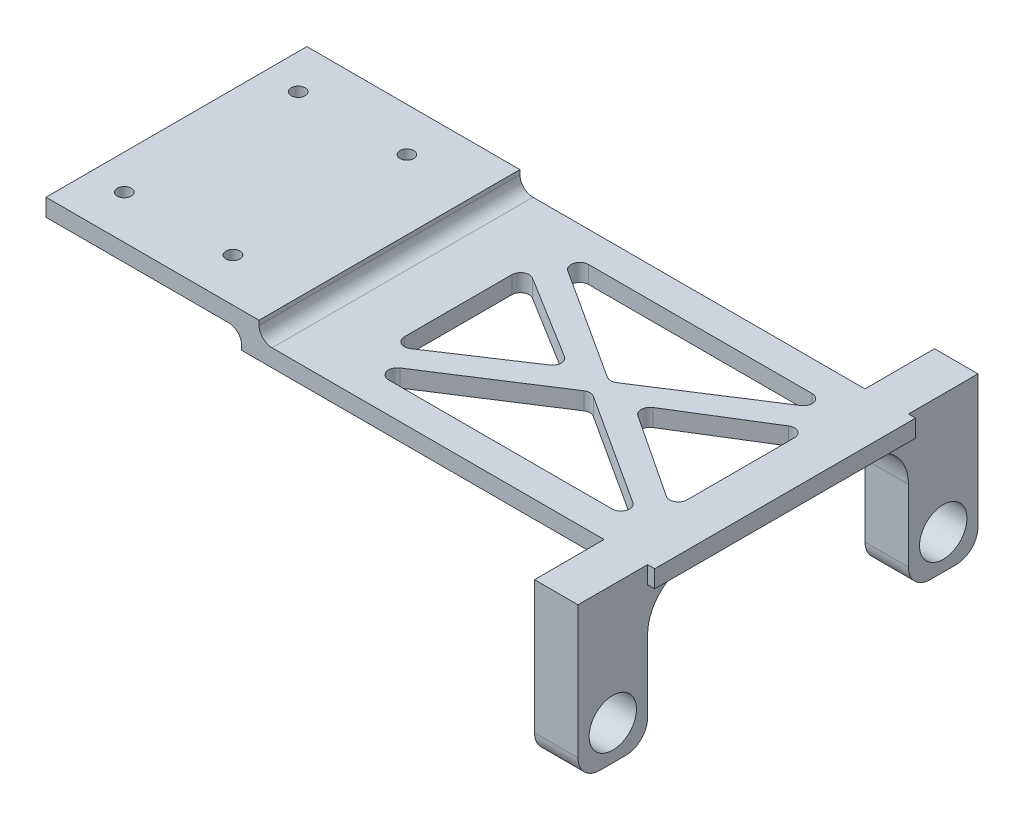
from build123d import *

# Parameters (mm, degrees)
BOSS_EXTRUDE1_DEPTH  = 60
FILLET1_R            = 3
CUT_EXTRUDE1_REACH   = 120.661
SKETCH2_R            = 1.6
CUT_EXTRUDE2_REACH   = 120.458
FILLET2_R            = 2
SKETCH5_W            = 10
SKETCH5_H            = 4
BOSS_EXTRUDE2_DEPTH  = 16
SKETCH6_W            = 10
SKETCH6_H            = 16
BOSS_EXTRUDE3_DEPTH  = 31.5
CUT_EXTRUDE3_REACH   = 163.612
SKETCH7_R            = 5.45
FILLET3_R            = 5
FILLET4_R            = 10
FILLET3_OF_MIRROR3_R = 5
FILLET4_OF_MIRROR3_R = 10


with BuildPart() as part:
    # Sketch1 → Boss-Extrude1 (new body)
    with BuildSketch(Plane.XY):
        Polygon((-37.939393939, 0.885392049), (7.060606061, 0.885392049), (7.060606061, -3.114607951), (102.060606061, -3.114607951), (102.060606061, 0.885392049), (11.060606061, 0.885392049), (11.060606061, 4.885392049), (-37.939393939, 4.885392049), align=None)
    extrude(amount=BOSS_EXTRUDE1_DEPTH)

    # Fillet1
    fillet1_edges = [part.edges().sort_by_distance(p)[0] for p in [
        (7.060606061, 0.885392049, 30),
        (11.060606061, 0.885392049, 30),
    ]]
    fillet(fillet1_edges, radius=FILLET1_R)

    # Sketch2 → Cut-Extrude1 (cut, up to next)
    with BuildSketch(Plane(origin=(0, 4.885392049, 0), x_dir=(1, 0, 0), z_dir=(0, 1, 0)), mode=Mode.PRIVATE) as cut_extrude1_sk1:
        with Locations(Location((-4.939393939, -50, 0), (0, 0, 180))):
            Circle(SKETCH2_R)
    cut_extrude1_tool1 = extrude(cut_extrude1_sk1.sketch, amount=-CUT_EXTRUDE1_REACH, mode=Mode.PRIVATE) & part.part
    # Sketch2 → Cut-Extrude1 (cut, up to next)
    with BuildSketch(Plane(origin=(0, 4.885392049, 0), x_dir=(1, 0, 0), z_dir=(0, 1, 0)), mode=Mode.PRIVATE) as cut_extrude1_sk2:
        with Locations(Location((-29.939393939, -50, 0), (0, 0, 180))):
            Circle(SKETCH2_R)
    cut_extrude1_tool2 = extrude(cut_extrude1_sk2.sketch, amount=-CUT_EXTRUDE1_REACH, mode=Mode.PRIVATE) & part.part
    cut_extrude1_1 = cut_extrude1_tool1.solids().sort_by_distance((-4.939394, 4.885392, 50))[0]
    add(cut_extrude1_1, mode=Mode.SUBTRACT)
    cut_extrude1_2 = cut_extrude1_tool2.solids().sort_by_distance((-29.939394, 4.885392, 50))[0]
    add(cut_extrude1_2, mode=Mode.SUBTRACT)
    cut_extrude1 = cut_extrude1_1 + cut_extrude1_2  # Cut-Extrude1 as one shape, for the pattern or mirror that repeats it

    # Mirror2: Cut-Extrude1 across plane
    add(cut_extrude1.mirror(Plane.XY.offset(30)), mode=Mode.SUBTRACT)

    # Sketch4 → Cut-Extrude2 (cut, up to next)
    with BuildSketch(Plane(origin=(0, 0.885392049, 0), x_dir=(1, 0, 0), z_dir=(0, 1, 0)), mode=Mode.PRIVATE) as cut_extrude2_sk1:
        Polygon((27.060606061, -14.276205352), (27.060606061, -46.276205352), (52.060606061, -29.743980797), align=None)
    cut_extrude2_tool1 = extrude(cut_extrude2_sk1.sketch, amount=-CUT_EXTRUDE2_REACH, mode=Mode.PRIVATE) & part.part
    # Sketch4 → Cut-Extrude2 (cut, up to next)
    with BuildSketch(Plane(origin=(0, 0.885392049, 0), x_dir=(1, 0, 0), z_dir=(0, 1, 0)), mode=Mode.PRIVATE) as cut_extrude2_sk2:
        Polygon((59.560606061, -32), (27.060606061, -53), (92.060606061, -53), align=None)
    cut_extrude2_tool2 = extrude(cut_extrude2_sk2.sketch, amount=-CUT_EXTRUDE2_REACH, mode=Mode.PRIVATE) & part.part
    # Sketch4 → Cut-Extrude2 (cut, up to next)
    with BuildSketch(Plane(origin=(0, 0.885392049, 0), x_dir=(1, 0, 0), z_dir=(0, 1, 0)), mode=Mode.PRIVATE) as cut_extrude2_sk3:
        Polygon((67.060606061, -29.743980797), (92.060606061, -14.276205352), (92.060606061, -46.276205352), align=None)
    cut_extrude2_tool3 = extrude(cut_extrude2_sk3.sketch, amount=-CUT_EXTRUDE2_REACH, mode=Mode.PRIVATE) & part.part
    # Sketch4 → Cut-Extrude2 (cut, up to next)
    with BuildSketch(Plane(origin=(0, 0.885392049, 0), x_dir=(1, 0, 0), z_dir=(0, 1, 0)), mode=Mode.PRIVATE) as cut_extrude2_sk4:
        Polygon((92.060606061, -7), (59.560606061, -28), (27.060606061, -7), align=None)
    cut_extrude2_tool4 = extrude(cut_extrude2_sk4.sketch, amount=-CUT_EXTRUDE2_REACH, mode=Mode.PRIVATE) & part.part
    add(cut_extrude2_tool1.solids().sort_by_distance((35.393939, 0.885392, 30.098797))[0], mode=Mode.SUBTRACT)
    add(cut_extrude2_tool2.solids().sort_by_distance((59.560606, 0.885392, 46))[0], mode=Mode.SUBTRACT)
    add(cut_extrude2_tool3.solids().sort_by_distance((83.727273, 0.885392, 30.098797))[0], mode=Mode.SUBTRACT)
    add(cut_extrude2_tool4.solids().sort_by_distance((59.560606, 0.885392, 14))[0], mode=Mode.SUBTRACT)

    # Fillet2
    fillet2_edges = [part.edges().sort_by_distance(p)[0] for p in [
        (59.560606061, -1.114607951, 32),
        (92.060606061, -1.114607951, 53),
        (27.060606061, -1.114607951, 53),
        (92.060606061, -1.114607951, 46.276205352),
        (67.060606061, -1.114607951, 29.743980797),
        (92.060606061, -1.114607951, 14.276205352),
        (27.060606061, -1.114607951, 7),
        (92.060606061, -1.114607951, 7),
        (59.560606061, -1.114607951, 28),
        (27.060606061, -1.114607951, 14.276205352),
        (52.060606061, -1.114607951, 29.743980797),
        (27.060606061, -1.114607951, 46.276205352),
    ]]
    fillet(fillet2_edges, radius=FILLET2_R)

    # Sketch5 → Boss-Extrude2 (add)
    with BuildSketch(Plane.XY.offset(60)):
        with Locations((95.422932692, -1.114607951)):
            Rectangle(SKETCH5_W, SKETCH5_H)
    boss_extrude2 = extrude(amount=BOSS_EXTRUDE2_DEPTH)

    # Sketch6 → Boss-Extrude3 (add)
    with BuildSketch(Plane.XZ.offset(3.114607951)):
        with Locations((95.422932692, 68)):
            Rectangle(SKETCH6_W, SKETCH6_H)
    boss_extrude3 = extrude(amount=BOSS_EXTRUDE3_DEPTH)

    # Sketch7 → Cut-Extrude3 (cut, up to next)
    with BuildSketch(Plane(origin=(100.422932692, 0, 0), x_dir=(0, 0, -1), z_dir=(1, 0, 0)), mode=Mode.PRIVATE) as cut_extrude3_sk1:
        with Locations((-68, -26.614607951)):
            Circle(SKETCH7_R)
    cut_extrude3_tool1 = extrude(cut_extrude3_sk1.sketch, amount=-CUT_EXTRUDE3_REACH, mode=Mode.PRIVATE) & part.part
    cut_extrude3 = cut_extrude3_tool1.solids().sort_by_distance((100.422933, -26.614608, 68))[0]
    add(cut_extrude3, mode=Mode.SUBTRACT)

    # Fillet3
    fillet3_edges = [part.edges().sort_by_distance(p)[0] for p in [
        (95.422932692, -34.614607951, 60),
        (95.422932692, -34.614607951, 76),
    ]]
    fillet(fillet3_edges, radius=FILLET3_R)

    # Fillet4
    fillet4_edges = [part.edges().sort_by_distance(p)[0] for p in [
        (95.422932692, -3.114607951, 60),
    ]]
    fillet(fillet4_edges, radius=FILLET4_R)

    # Mirror3: Boss-Extrude2, Boss-Extrude3, Cut-Extrude3 across plane
    add(boss_extrude2.mirror(Plane.XY.offset(30)))
    add(boss_extrude3.mirror(Plane.XY.offset(30)))
    add(cut_extrude3.mirror(Plane.XY.offset(30)), mode=Mode.SUBTRACT)

    # Fillet3 of Mirror3
    fillet3_of_mirror3_edges = [part.edges().sort_by_distance(p)[0] for p in [
        (95.422932692, -34.614607951, 0),
        (95.422932692, -34.614607951, -16),
    ]]
    fillet(fillet3_of_mirror3_edges, radius=FILLET3_OF_MIRROR3_R)

    # Fillet4 of Mirror3
    fillet4_of_mirror3_edges = [part.edges().sort_by_distance(p)[0] for p in [
        (95.422932692, -3.114607951, 0),
    ]]
    fillet(fillet4_of_mirror3_edges, radius=FILLET4_OF_MIRROR3_R)


solid = part.part
